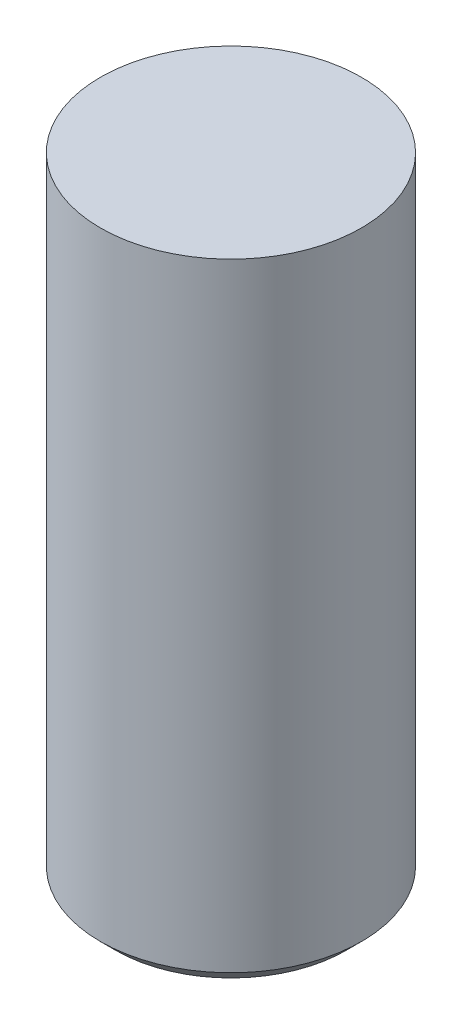
from build123d import *

# Parameters (mm, degrees)
SKETCH1_R           = 16.9
BOSS_EXTRUDE1_DEPTH = 41
CHAMFER1_SIZE       = 2


with BuildPart() as part:
    # Sketch1 → Boss-Extrude1 (new, symmetric)
    with BuildSketch(Plane(origin=(0, 0, 0), x_dir=(1, 0, 0), z_dir=(0, 1, 0))):
        with Locations(Location((0, 0, 0), (0, 0, 270))):
            Circle(SKETCH1_R)
    extrude(amount=BOSS_EXTRUDE1_DEPTH, both=True)

    # Chamfer1
    chamfer1_edges = [part.edges().sort_by_distance(p)[0] for p in [
        (0, -41, -16.9),
    ]]
    chamfer(chamfer1_edges, length=CHAMFER1_SIZE)


solid = part.part
